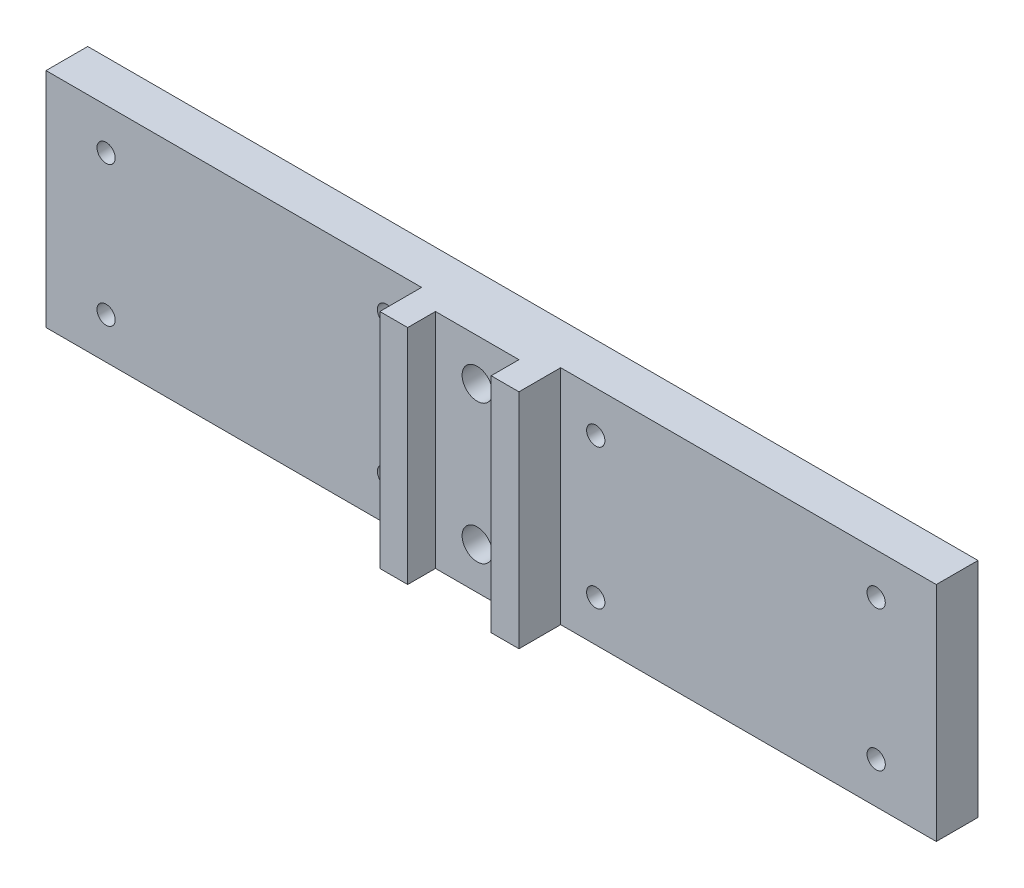
from build123d import *

# Parameters (mm, degrees)
SKETCH1_W                       = 101.6
SKETCH1_H                       = 25.4
BOSS_EXTRUDE1_DEPTH             = 9.525
SKETCH2_W                       = 9.525
SKETCH2_H                       = 3.175
SKETCH2_W_2                     = 42.8625
SKETCH2_H_2                     = 4.7625
CUT_EXTRUDE1_DEPTH              = 106.159144277
F_8_32_TAPPED_HOLE1_D           = 3.4544
F_45_0_082_DIAMETER_HOLE1_D     = 2.0828
F_45_0_082_DIAMETER_HOLE1_DEPTH = 9.652
F_45_0_082_DIAMETER_HOLE1_TIP   = 0.625736249


with BuildPart() as part:
    # Sketch1 → Boss-Extrude1 (new body)
    with BuildSketch(Plane.XY):
        with Locations((50.8, 12.7)):
            Rectangle(SKETCH1_W, SKETCH1_H)
    extrude(amount=BOSS_EXTRUDE1_DEPTH)

    # Sketch2 → Cut-Extrude1 (cut, through all)
    with BuildSketch(Plane(origin=(0, 25.4, 0), x_dir=(1, 0, 0), z_dir=(0, 1, 0))):
        with Locations((50.8, -7.9375)):
            Rectangle(SKETCH2_W, SKETCH2_H)
        with Locations((21.43125, -7.14375)):
            Rectangle(SKETCH2_W_2, SKETCH2_H_2)
        with Locations((80.16875, -7.14375)):
            Rectangle(SKETCH2_W_2, SKETCH2_H_2)
    extrude(amount=-CUT_EXTRUDE1_DEPTH, mode=Mode.SUBTRACT)

    # #8-32 Tapped Hole1 (through all)
    with Locations(Plane.XY.offset(6.35)):
        with Locations((50.8, 4.7625), (50.8, 20.6375)):
            Hole(F_8_32_TAPPED_HOLE1_D / 2)

    # #45 (0.082) Diameter Hole1
    with Locations(Plane(origin=(0, 0, 0), x_dir=(-1, 0, 0), z_dir=(0, 0, -1))):
        with Locations((-38.86, 20.7), (-6.86, 20.7), (-38.86, 4.7), (-6.86, 4.7), (-62.74, 4.7), (-94.74, 4.7), (-62.74, 20.7), (-94.74, 20.7)):
            Hole(F_45_0_082_DIAMETER_HOLE1_D / 2, depth=F_45_0_082_DIAMETER_HOLE1_DEPTH)
            with Locations((0, 0, -(F_45_0_082_DIAMETER_HOLE1_DEPTH + F_45_0_082_DIAMETER_HOLE1_TIP / 2))):  # 118° drill point
                Cone(0, F_45_0_082_DIAMETER_HOLE1_D / 2, F_45_0_082_DIAMETER_HOLE1_TIP, mode=Mode.SUBTRACT)


solid = part.part
